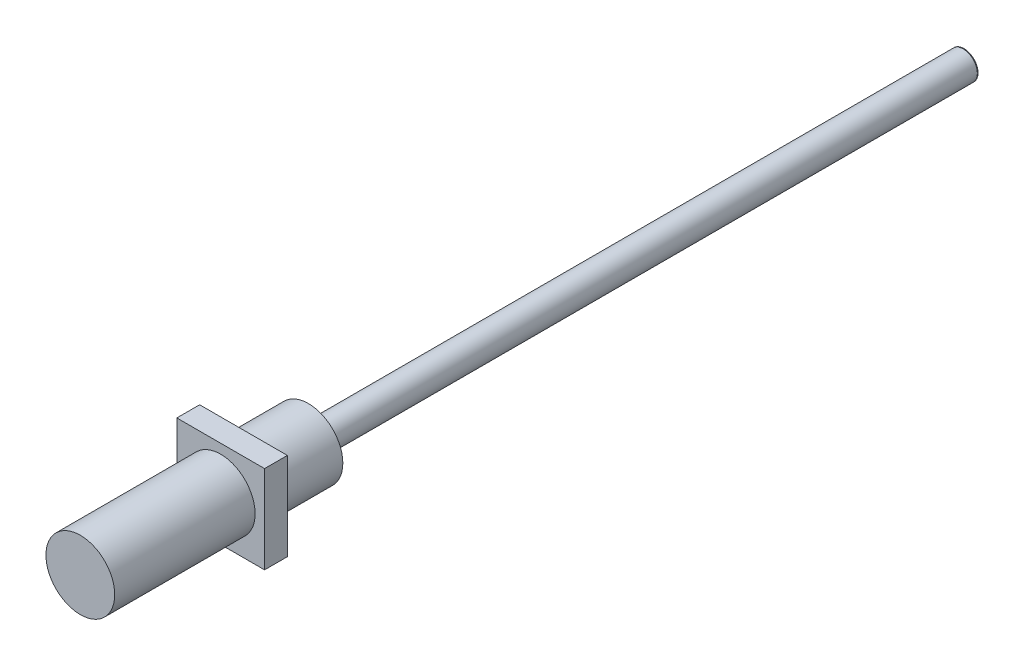
from build123d import *

# Parameters (mm, degrees)
SKETCH1_R           = 1.016
BOSS_EXTRUDE1_DEPTH = 47.371
BOSS_EXTRUDE2_START = 0.0254
SKETCH2_R           = 1.016
BOSS_EXTRUDE2_DEPTH = 0.0254
SKETCH3_W           = 1.27
SKETCH3_H           = 1.27
BOSS_EXTRUDE3_DEPTH = 0.0254
BOSS_EXTRUDE4_START = 0.0254
SKETCH4_R           = 1.016
BOSS_EXTRUDE4_DEPTH = 0.0254
SKETCH5_R           = 2.4892
BOSS_EXTRUDE5_DEPTH = 4.699
SKETCH6_W           = 6.35
SKETCH6_H           = 6.35
BOSS_EXTRUDE6_DEPTH = 1.651
SKETCH7_R           = 2.4892
BOSS_EXTRUDE7_DEPTH = 10.16


with BuildPart() as part:
    # Sketch1 → Boss-Extrude1 (new body)
    with BuildSketch(Plane.XY):
        Circle(SKETCH1_R)
    extrude(amount=BOSS_EXTRUDE1_DEPTH)

    # Sketch2 → Boss-Extrude2 (add)
    with BuildSketch(Plane(origin=(0, 0, 0), x_dir=(-1, 0, 0), z_dir=(0, 0, -1)).offset(BOSS_EXTRUDE2_START)):
        Circle(SKETCH2_R)
    extrude(amount=-BOSS_EXTRUDE2_DEPTH)

    # Sketch3 → Boss-Extrude3 (add)
    with BuildSketch(Plane(origin=(0, 0, -0.0254), x_dir=(-1, 0, 0), z_dir=(0, 0, -1))):
        Rectangle(SKETCH3_W, SKETCH3_H)
    extrude(amount=BOSS_EXTRUDE3_DEPTH)

    # Sketch4 → Boss-Extrude4 (add)
    with BuildSketch(Plane(origin=(0, 0, -0.0508), x_dir=(-1, 0, 0), z_dir=(0, 0, -1)).offset(BOSS_EXTRUDE4_START)):
        Circle(SKETCH4_R)
    extrude(amount=-BOSS_EXTRUDE4_DEPTH)

    # Sketch5 → Boss-Extrude5 (add)
    with BuildSketch(Plane.XY.offset(47.371)):
        Circle(SKETCH5_R)
    extrude(amount=BOSS_EXTRUDE5_DEPTH)

    # Sketch6 → Boss-Extrude6 (add)
    with BuildSketch(Plane.XY.offset(52.07)):
        Rectangle(SKETCH6_W, SKETCH6_H)
    extrude(amount=BOSS_EXTRUDE6_DEPTH)

    # Sketch7 → Boss-Extrude7 (add)
    with BuildSketch(Plane.XY.offset(53.721)):
        Circle(SKETCH7_R)
    extrude(amount=BOSS_EXTRUDE7_DEPTH)


solid = part.part
